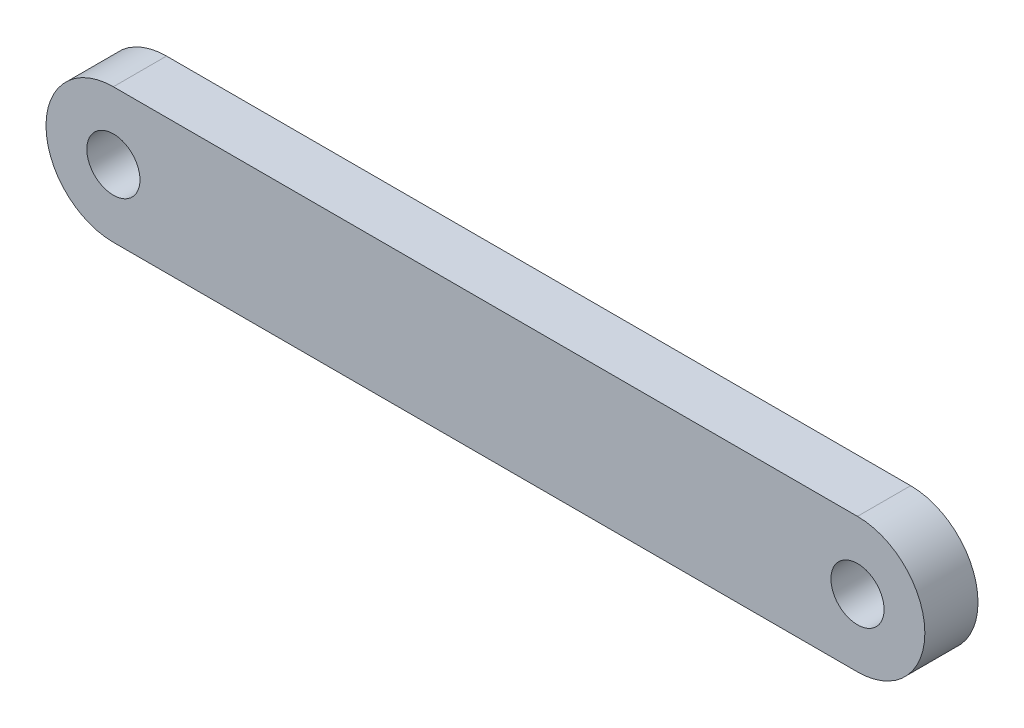
from build123d import *

# Parameters (mm, degrees)
SKETCH1_R           = 1
BOSS_EXTRUDE1_DEPTH = 2


with BuildPart() as part:
    # Sketch1 → Boss-Extrude1 (new body)
    with BuildSketch(Plane.XY):
        with BuildLine():
            Line((-13.025069638, 2.534818942), (14.974930362, 2.534818942))
            ThreePointArc((14.974930362, 2.534818942), (17.509749304, 0), (14.974930362, -2.534818942))
            Line((14.974930362, -2.534818942), (-13.025069638, -2.534818942))
            ThreePointArc((-13.025069638, -2.534818942), (-15.559888579, 0), (-13.025069638, 2.534818942))
        make_face()
        with Locations((14.974930362, 0)):
            Circle(SKETCH1_R, mode=Mode.SUBTRACT)
        with Locations((-13.025069638, 0)):
            Circle(SKETCH1_R, mode=Mode.SUBTRACT)
    extrude(amount=BOSS_EXTRUDE1_DEPTH)


solid = part.part
